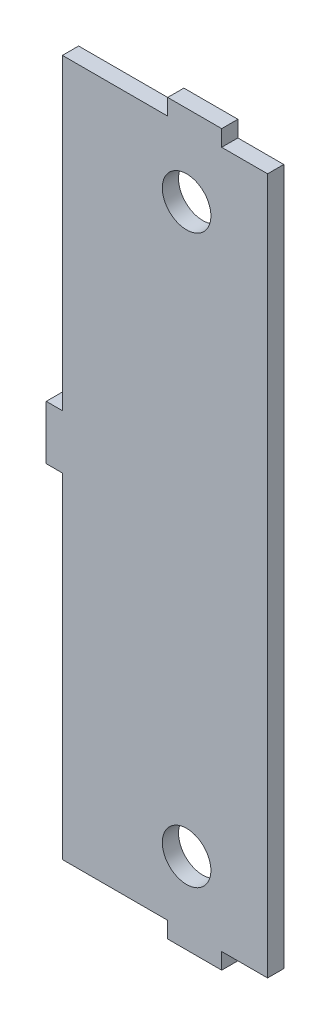
from build123d import *

# Parameters (mm, degrees)
BOSS_EXTRUDE1_DEPTH = 3
SKETCH3_R           = 4.5
CUT_EXTRUDE4_DEPTH  = 80.033220863


with BuildPart() as part:
    # Sketch2 → Boss-Extrude1 (new body)
    with BuildSketch(Plane.XY):
        Polygon((0, 64.5), (-8.5, 64.5), (-8.5, 67.5), (-18.5, 67.5), (-18.5, 64.5), (-38, 64.5), (-38, 7.5), (-41, 7.5), (-41, -2.5), (-38, -2.5), (-38, -64.5), (-18.5, -64.5), (-18.5, -67.5), (-8.5, -67.5), (-8.5, -64.5), (0, -64.5), align=None)
    extrude(amount=BOSS_EXTRUDE1_DEPTH)

    # Sketch3 → Cut-Extrude4 (cut, through all)
    with BuildSketch(Plane.XY):
        with Locations((-15, 52.5)):
            Circle(SKETCH3_R)
        with Locations((-15, -52.5)):
            Circle(SKETCH3_R)
    extrude(amount=CUT_EXTRUDE4_DEPTH, mode=Mode.SUBTRACT)


solid = part.part
